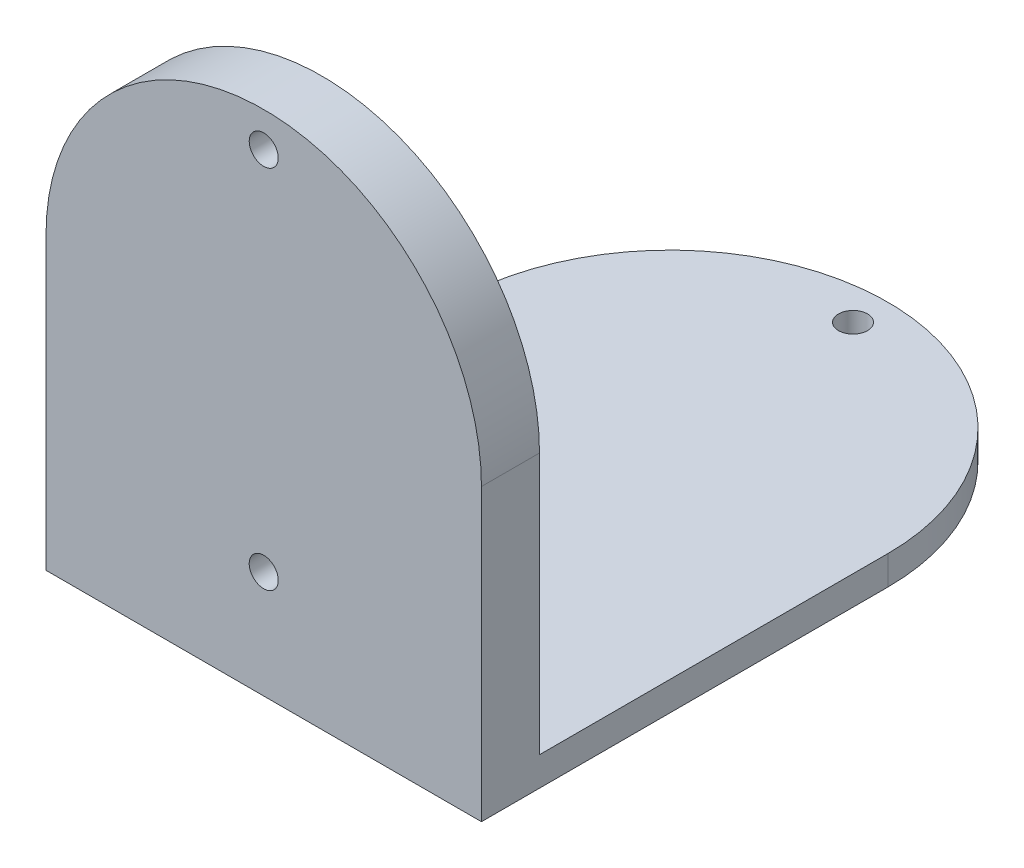
from build123d import *

# Parameters (mm, degrees)
EXTRUDE_1_DEPTH     = 5
SKETCH_18_W         = 75
SKETCH_18_H         = 10
EXTRUDE_2_DEPTH     = 30
SKETCH_19_R         = 2.5
CUT_EXTRUDE_3_DEPTH = 85.889634232
EXTRUDE_3_DEPTH     = 10
SKETCH_21_R         = 2.5
CUT_EXTRUDE_4_DEPTH = 137.267200749


with BuildPart() as part:
    # ｽｹｯﾁ1 → ﾎﾞｽ - 押し出し1 (new body)
    with BuildSketch(Plane(origin=(0, 0, 0), x_dir=(1, 0, 0), z_dir=(0, 1, 0))):
        with BuildLine():
            Line((-37.5, 0), (-37.5, -70))
            Line((-37.5, -70), (37.5, -70))
            Line((37.5, -70), (37.5, 0))
            ThreePointArc((37.5, 0), (0, 37.5), (-37.5, 0))
        make_face()
    extrude(amount=EXTRUDE_1_DEPTH)

    # ｽｹｯﾁ18 → ﾎﾞｽ - 押し出し2 (add)
    with BuildSketch(Plane(origin=(0, 5, 0), x_dir=(1, 0, 0), z_dir=(0, 1, 0))):
        with Locations((0, -65)):
            Rectangle(SKETCH_18_W, SKETCH_18_H)
    extrude(amount=EXTRUDE_2_DEPTH)

    # ｽｹｯﾁ19 → ｶｯﾄ - 押し出し3 (cut, through all)
    with BuildSketch(Plane(origin=(0, 5, 0), x_dir=(1, 0, 0), z_dir=(0, 1, 0))):
        with Locations(Location((0, 31.5, 0), (0, 0, 270))):
            Circle(SKETCH_19_R)
        with Locations(Location((0, -31.5, 0), (0, 0, 90))):
            Circle(SKETCH_19_R)
    extrude(amount=-CUT_EXTRUDE_3_DEPTH, mode=Mode.SUBTRACT)

    # ｽｹｯﾁ20 → ﾎﾞｽ - 押し出し3 (add)
    with BuildSketch(Plane.XY.offset(70)):
        with BuildLine():
            Line((-37.5, 50), (-37.5, 35))
            Line((-37.5, 35), (37.5, 35))
            Line((37.5, 35), (37.5, 50))
            ThreePointArc((37.5, 50), (0, 87.5), (-37.5, 50))
        make_face()
    extrude(amount=-EXTRUDE_3_DEPTH)

    # ｽｹｯﾁ21 → ｶｯﾄ - 押し出し4 (cut, through all)
    with BuildSketch(Plane(origin=(0, 0, 60), x_dir=(-1, 0, 0), z_dir=(0, 0, -1))):
        with Locations((0, 81.5)):
            Circle(SKETCH_21_R)
        with Locations(Location((0, 18.5, 0), (0, 0, 180))):
            Circle(SKETCH_21_R)
    extrude(amount=-CUT_EXTRUDE_4_DEPTH, mode=Mode.SUBTRACT)


solid = part.part
